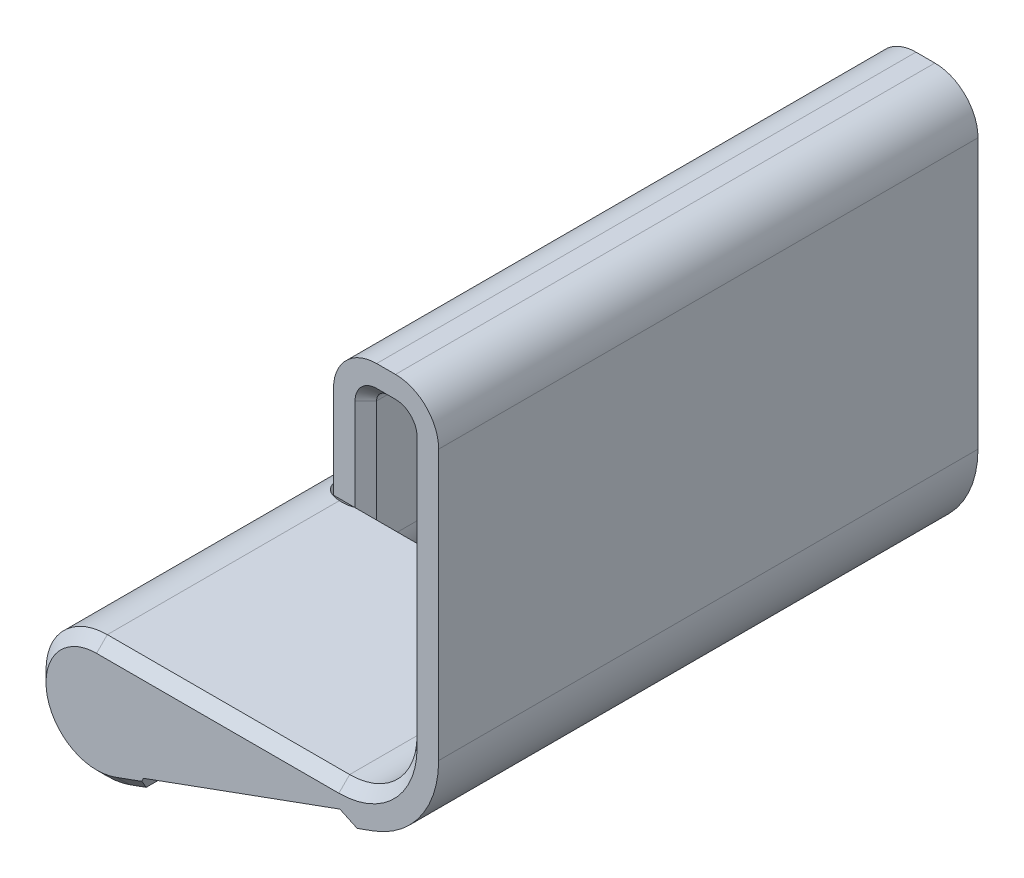
from build123d import *

# Parameters (mm, degrees)
BOSS_EXTRUDE1_DEPTH = 40
CUT_EXTRUDE2_DEPTH  = 53.049260875
SKETCH4_R           = 2
CUT_EXTRUDE3_DEPTH  = 10
CHAMFER2_SIZE       = 0.8
CUT_EXTRUDE1_DEPTH  = 54.113704366
FILLET2_R           = 0.8


with BuildPart() as part:
    # Sketch1 → Boss-Extrude1 (new body)
    with BuildSketch(Plane.XY):
        with BuildLine():
            Line((2.4, 0), (2.4, 9.2))
            ThreePointArc((2.4, 9.2), (2.634314575, 9.765685425), (3.2, 10))
            Line((3.2, 10), (4.6, 10))
            ThreePointArc((4.6, 10), (5.165685425, 9.765685425), (5.4, 9.2))
            Line((5.4, 9.2), (5.4, -10.8))
            ThreePointArc((5.4, -10.8), (3.935533906, -14.335533906), (0.4, -15.8))
            Line((0.4, -15.8), (-17.573004072, -15.8))
            ThreePointArc((-17.573004072, -15.8), (-22.12083665, -20.347832578), (-17.573004072, -24.895665156))
            ThreePointArc((-17.573004072, -24.895665156), (-16.704763183, -24.819703921), (-15.862903355, -24.59412826))
            Line((-15.862903355, -24.59412826), (2.930949061, -17.753725394))
            ThreePointArc((2.930949061, -17.753725394), (6.461725128, -15.044465629), (7.8, -10.8))
            Line((7.8, -10.8), (7.8, 9.2))
            ThreePointArc((7.8, 9.2), (6.8627417, 11.4627417), (4.6, 12.4))
            Line((4.6, 12.4), (3.2, 12.4))
            ThreePointArc((3.2, 12.4), (0.9372583, 11.4627417), (0, 9.2))
            Line((0, 9.2), (0, 0))
            ThreePointArc((0, 0), (-0.121792748, -0.612293492), (-0.46862915, -1.13137085))
            Line((-0.46862915, -1.13137085), (-3.297056275, -3.959797975))
            Line((-3.297056275, -3.959797975), (-1.6, -5.656854249))
            Line((-1.6, -5.656854249), (1.228427125, -2.828427125))
            ThreePointArc((1.228427125, -2.828427125), (2.09551813, -1.530733729), (2.4, 0))
        make_face()
    extrude(amount=BOSS_EXTRUDE1_DEPTH)

    # Sketch3 → Cut-Extrude2 (cut, through all)
    with BuildSketch(Plane.XY.offset(40)):
        Polygon((-14.090615102, -22.884890317), (0.474620521, -17.583578096), (1.756333285, -18.181250573), (-14.688287579, -24.166603081), align=None)
    extrude(amount=-CUT_EXTRUDE2_DEPTH, mode=Mode.SUBTRACT)

    # Sketch4 → Cut-Extrude3 (cut)
    with BuildSketch(Plane(origin=(6.048793264, -16.618922909, 0), x_dir=(0.939692620785907, 0.34202014332567265, 0), z_dir=(0.34202014332567265, -0.939692620785907, 0))):
        with Locations(Location((-4.901273833, 20, 0), (0, 0, 322.341537994))):
            Circle(SKETCH4_R)
        with Locations(Location((-21.734607166, 20, 0), (0, 0, 289.471220634))):
            Circle(SKETCH4_R)
    extrude(amount=-CUT_EXTRUDE3_DEPTH, mode=Mode.SUBTRACT)

    # Chamfer2
    chamfer2_edges = [part.edges().sort_by_distance(p)[0] for p in [
        (-0.185786438, -4.242640687, 40),
        (2.09551813, -1.530733729, 40),
        (2.4, 4.6, 40),
        (2.634314575, 9.765685425, 40),
        (3.9, 10, 40),
        (5.165685425, 9.765685425, 40),
        (5.4, -0.8, 40),
        (3.935533906, -14.335533906, 40),
        (-8.586502036, -15.8, 40),
        (-22.12083665, -20.347832578, 40),
        (-16.704763183, -24.819703921, 40),
        (-15.275595467, -24.380365671, 40),
    ]]
    chamfer(chamfer2_edges, length=CHAMFER2_SIZE)

    # Sketch2 → Cut-Extrude1 (cut, through all)
    with BuildSketch(Plane(origin=(2.4, 0, 0), x_dir=(0, 0, -1), z_dir=(1, 0, 0))):
        Polygon((-40, 2.343145751), (-32, -5.656854249), (-40, -5.656854249), align=None)
        Polygon((0, 2.343145751), (-8, -5.656854249), (0, -5.656854249), align=None)
    extrude(amount=-CUT_EXTRUDE1_DEPTH, mode=Mode.SUBTRACT)

    # Fillet2
    fillet2_edges = [part.edges().sort_by_distance(p)[0] for p in [
        (-1.6, -5.656854249, 20),
        (-3.297056275, -3.959797975, 20),
    ]]
    fillet(fillet2_edges, radius=FILLET2_R)


solid = part.part
